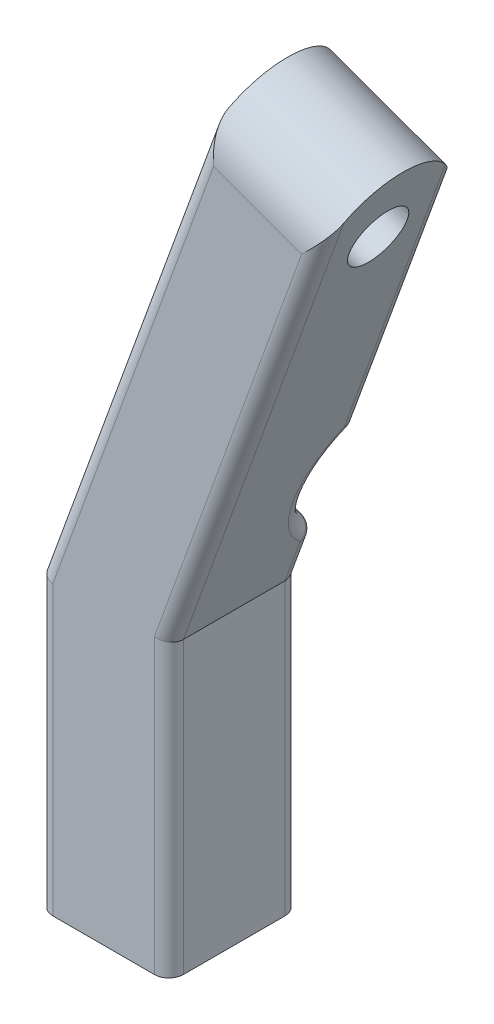
from build123d import *

# Parameters (mm, degrees)
Y_KSEKLIK_EKSTR_ZYON1_DEPTH = 9
IZIM2_R                     = 2.5000000000000013
KES_EKSTR_ZYON1_DEPTH       = 15
IZIM3_R                     = 5.000000000000001
KES_EKSTR_ZYON2_DEPTH       = 15
RADYUS1_R                   = 1
RADYUS3_R                   = 1
RADYUS4_R                   = 1
KES_EKSTR_ZYON3_DEPTH       = 15
IZIM5_R                     = 2.000000000000001
KES_EKSTR_ZYON4_DEPTH       = 15


with BuildPart() as part:
    # Çizim1 → Yükseklik-Ekstrüzyon1 (new body)
    with BuildSketch(Plane.XY):
        Polygon((0, 0), (0, 20), (12.681484879037361, 54.8420933503103), (20.62868487307276, 51.94954910672088), (8.999999999999998, 20), (9, 1.2e-16), align=None)
    extrude(amount=Y_KSEKLIK_EKSTR_ZYON1_DEPTH)

    # Çizim2 → Kes-Ekstrüzyon1 (cut)
    with BuildSketch(Plane.XZ):
        with Locations((4.5, 4.5)):
            Circle(IZIM2_R)
    extrude(amount=-KES_EKSTR_ZYON1_DEPTH, mode=Mode.SUBTRACT)

    # Çizim3 → Kes-Ekstrüzyon2 (cut)
    with BuildSketch(Plane(origin=(1.5193238971699898, -0.5529886747792022, 0), x_dir=(0, 0, -1), z_dir=(0.9396926207859082, -0.34202014332566955, 0))):
        with Locations((3, 29.37203370564919)):
            Circle(IZIM3_R)
    extrude(amount=-KES_EKSTR_ZYON2_DEPTH, mode=Mode.SUBTRACT)

    # Radyus1
    radyus1_edges = [part.edges().sort_by_distance(p)[0] for p in [
        (6.223470504622144, 24.7351962945454, 0),
        (8.959631651227502, 32.252737260832674, 0),
    ]]
    fillet(radyus1_edges, radius=RADYUS1_R)

    # Radyus3
    radyus3_edges = [part.edges().sort_by_distance(p)[0] for p in [
        (11.565151074942523, 27.047694655894322, 2.000000000000001),
        (3.617951080907128, 29.940238899483752, 2.000000000000001),
        (16.86169826415806, 41.59983845933982, 0),
        (10.175219633458596, 23.228889405827225, 0.08712907082472376),
        (12.95508251642645, 30.866499905961415, 0.08712907082472277),
        (1.0441952503031455, 22.868902871709654, 0),
        (2.2280196394232012, 26.12143364941666, 0.08712907082472376),
        (5.007882522391055, 33.75904414955085, 0.08712907082472277),
        (0, 10, 0),
        (8.914498270122662, 44.49238270292925, 0),
        (9.51779524732084, 21.422630749914934, 0),
        (9, 10, 0),
    ]]
    fillet(radyus3_edges, radius=RADYUS3_R)

    # Radyus4
    radyus4_edges = [part.edges().sort_by_distance(p)[0] for p in [
        (14.814342436536379, 35.97477455336044, 9),
        (6.340742439518681, 37.421046675155154, 9),
        (0, 10, 9),
        (9, 10, 9),
    ]]
    fillet(radyus4_edges, radius=RADYUS4_R)

    # Çizim4 → Kes-Ekstrüzyon3 (cut)
    with BuildSketch(Plane(origin=(1.5193238971699898, -0.5529886747792022, 0), x_dir=(0, 0, -1), z_dir=(0.9396926207859082, -0.34202014332566955, 0))):
        with BuildLine():
            Line((-9, 55.872033705649194), (-9.000000000000002, 51.372033705649194))
            ThreePointArc((-9, 51.372033705649194), (-8.742640687119316, 52.872033705649116), (-8.00000000000011, 54.20046083039526))
            Line((-8, 54.20046083039522), (-8, 55.8720337056492))
            Line((-8, 55.872033705649194), (-9, 55.872033705649194))
        make_face()
        with BuildLine():
            Line((-8, 55.8720337056492), (-8, 54.20046083039522))
            ThreePointArc((-8.00000000000011, 54.20046083039526), (-6.4393398282202545, 55.43269387742899), (-4.499999999999992, 55.8720337056492))
            Line((-4.499999999999992, 55.872033705649194), (-8, 55.872033705649194))
        make_face()
        with BuildLine():
            Line((-1, 55.872033705649194), (-4.499999999999992, 55.872033705649194))
            ThreePointArc((-4.499999999999993, 55.8720337056492), (-2.5606601717797366, 55.43269387742899), (-0.9999999999998863, 54.20046083039526))
            Line((-0.999999999999999, 54.20046083039522), (-0.9999999999999991, 55.8720337056492))
        make_face()
        with BuildLine():
            Line((0, 55.872033705649194), (-1, 55.872033705649194))
            Line((-0.9999999999999991, 55.8720337056492), (-0.999999999999999, 54.20046083039522))
            ThreePointArc((-0.9999999999998863, 54.20046083039526), (-0.2573593128806797, 52.872033705649116), (4.44e-15, 51.372033705649194))
            Line((4.34e-15, 51.372033705649194), (0, 55.872033705649194))
        make_face()
    extrude(amount=-KES_EKSTR_ZYON3_DEPTH, mode=Mode.SUBTRACT)

    # Çizim5 → Kes-Ekstrüzyon4 (cut)
    with BuildSketch(Plane(origin=(-6.427876096865405, 2.339555568810229, 0), x_dir=(0, 0, 1), z_dir=(-0.9396926207859082, 0.34202014332566943, 0))):
        with Locations(Location((4.499999999999999, 50.872033705649216, 0), (0, 0, 270))):
            Circle(IZIM5_R)
    extrude(amount=-KES_EKSTR_ZYON4_DEPTH, mode=Mode.SUBTRACT)


solid = part.part
